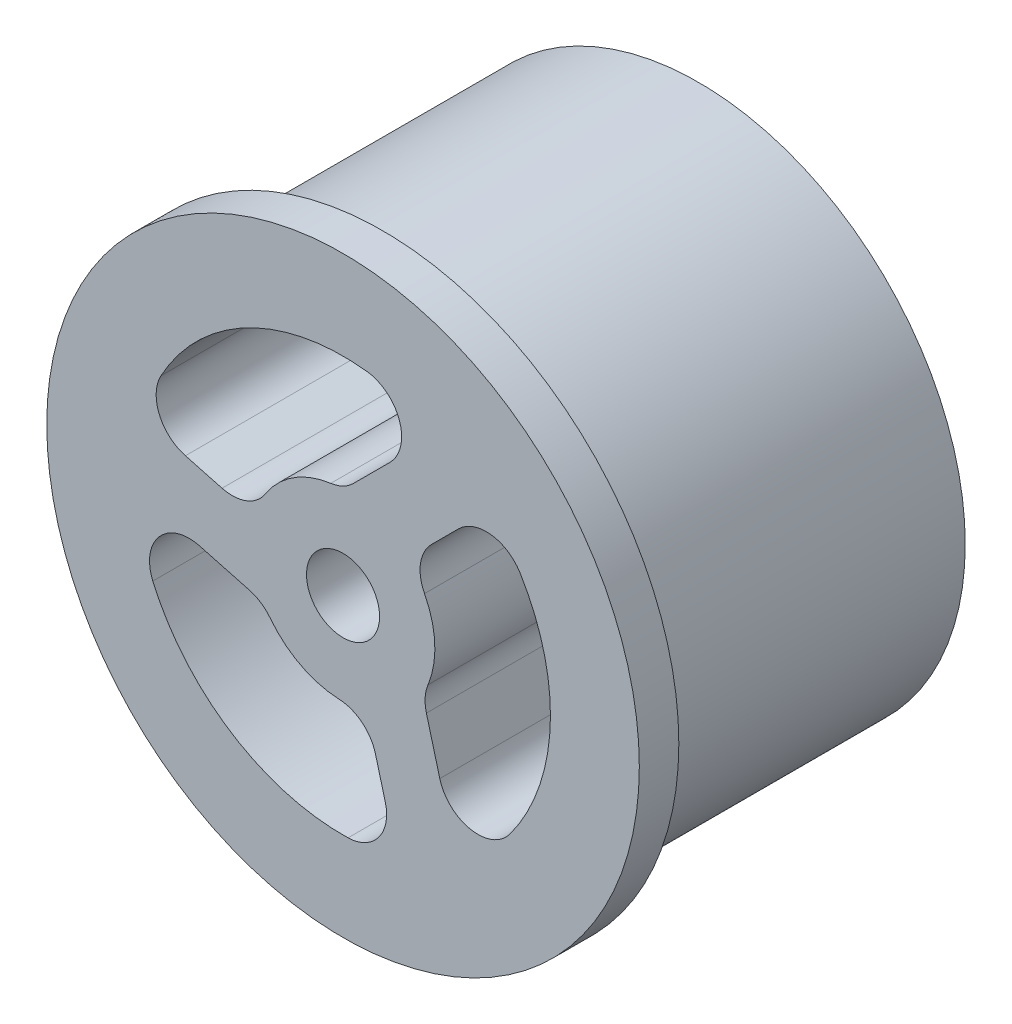
from build123d import *

# Parameters (mm, degrees)
SKETCH_1_R      = 6.75
SKETCH_1_R_2    = 5.25
EXTRUDE_1_DEPTH = 9
SKETCH_2_R      = 0.925
EXTRUDE_2_DEPTH = 9
FILLET_1_R      = 1
EXTRUDE_START   = -1
SKETCH_3_R      = 7.5
SKETCH_3_R_2    = 6.75
EXTRUDE_3_DEPTH = 1
FILLET_2_R      = 1


with BuildPart() as part:
    # 草图1 → 凸台-拉伸1 (new body)
    with BuildSketch(Plane.XY):
        Circle(SKETCH_1_R)
        Circle(SKETCH_1_R_2, mode=Mode.SUBTRACT)
    extrude(amount=EXTRUDE_1_DEPTH)

    # 草图2 → 凸台-拉伸2 (add)
    with BuildSketch(Plane.XY.offset(9)):
        with BuildLine():
            ThreePointArc((0, 2.325), (-1.415370322, 1.844546516), (-2.245777546, 0.60175428))
            Line((-2.245777546, 0.60175428), (-5.780506882, 1.548882151))
            Line((-5.780506882, 1.548882151), (-6.206011413, -0.039122381))
            Line((-6.206011413, -0.039122381), (-2.013509064, -1.1625))
            ThreePointArc((-2.013509064, -1.1625), (-0.88973898, -2.148019913), (0.60175428, -2.245777546))
            Line((0.60175428, -2.245777546), (1.548882151, -5.780506882))
            Line((1.548882151, -5.780506882), (3.136886683, -5.35500235))
            Line((3.136886683, -5.35500235), (2.013509064, -1.1625))
            ThreePointArc((2.013509064, -1.1625), (2.305109303, 0.303473397), (1.644023266, 1.644023266))
            Line((1.644023266, 1.644023266), (4.231624731, 4.231624731))
            Line((4.231624731, 4.231624731), (3.069124731, 5.394124731))
            Line((3.069124731, 5.394124731), (0, 2.325))
        make_face()
        Circle(SKETCH_2_R, mode=Mode.SUBTRACT)
    extrude(amount=-EXTRUDE_2_DEPTH)

    # 圆角1
    fillet_1_edges = [part.edges().sort_by_distance(p)[0] for p in [
        (0.60175428, -2.245777546, 4.5),
        (-2.013509064, -1.1625, 4.5),
        (-5.071110588, 1.358799987, 4.5),
        (-2.245777546, 0.60175428, 4.5),
        (0, 2.325, 4.5),
        (3.712310601, 3.712310601, 4.5),
        (1.644023266, 1.644023266, 4.5),
        (2.013509064, -1.1625, 4.5),
        (1.358799987, -5.071110588, 4.5),
    ]]
    fillet(fillet_1_edges, radius=FILLET_1_R)

    # 草图3 → 凸台-拉伸3 (add)
    with BuildSketch(Plane.XY.offset(9).offset(EXTRUDE_START)):
        Circle(SKETCH_3_R)
        Circle(SKETCH_3_R_2, mode=Mode.SUBTRACT)
    extrude(amount=EXTRUDE_3_DEPTH)

    # 圆角2
    fillet_2_edges = [part.edges().sort_by_distance(p)[0] for p in [
        (-5.241561446, -0.297545971, 4.5),
        (2.363098353, 4.688098353, 4.5),
        (2.878463093, -4.390552382, 4.5),
    ]]
    fillet(fillet_2_edges, radius=FILLET_2_R)


solid = part.part
